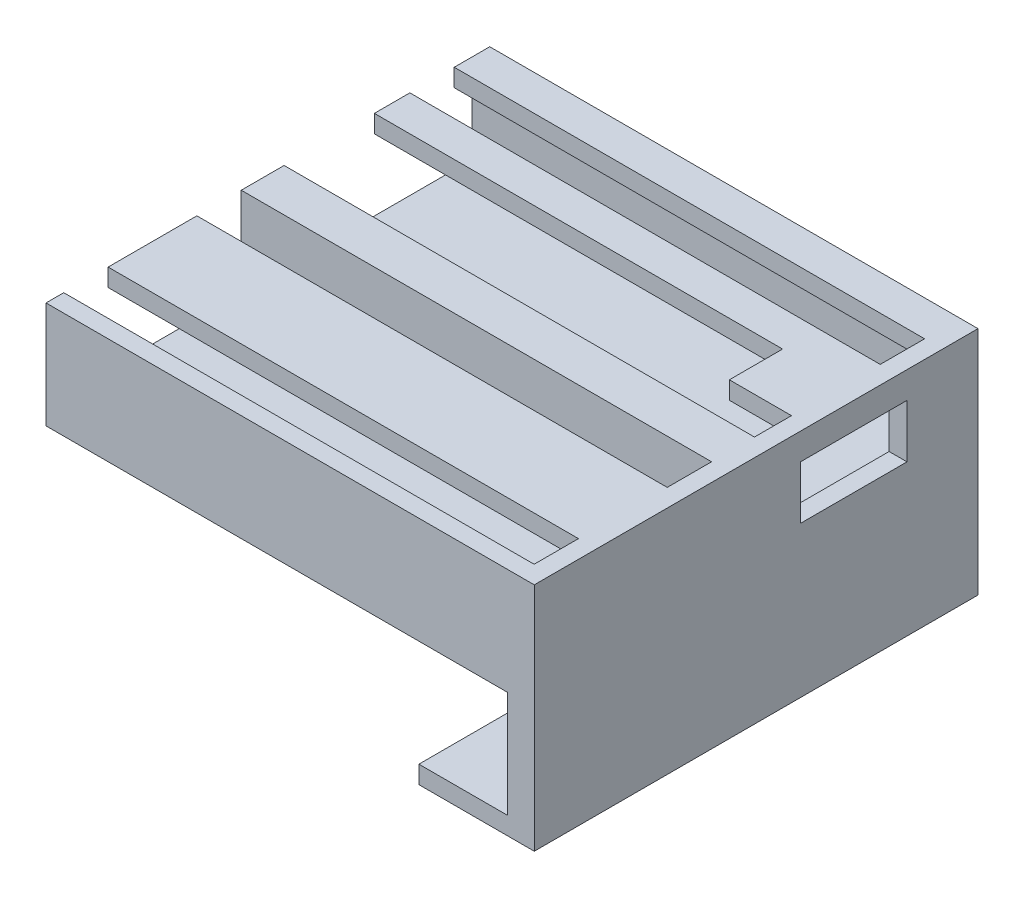
from build123d import *

# Parameters (mm, degrees)
SKETCH_1_W          = 55
SKETCH_1_H          = 50
EXTRUDE_1_DEPTH     = 2
SKETCH_2_W          = 2.016430074
SKETCH_2_H          = 50
EXTRUDE_2_DEPTH     = 10
SKETCH_4_W          = 10
SKETCH_4_H          = 2
SKETCH_4_W_2        = 2
SKETCH_4_H_2        = 10
EXTRUDE_3_DEPTH     = 53
SKETCH_5_W          = 12
SKETCH_5_H          = 6
CUT_EXTRUDE_1_DEPTH = 40
SKETCH_6_W          = 46
SKETCH_6_H          = 6
CUT_EXTRUDE_3_DEPTH = 2
SKETCH_7_W          = 3
SKETCH_7_H          = 50
EXTRUDE_4_DEPTH     = 14
SKETCH_8_W          = 50
SKETCH_8_H          = 2
EXTRUDE_5_DEPTH     = 10


with BuildPart() as part:
    # 草图1 → 凸台-拉伸1 (new body)
    with BuildSketch(Plane(origin=(0, 0, 0), x_dir=(1, 0, 0), z_dir=(0, 1, 0))):
        with Locations((-15.105645182, 3.897173973)):
            Rectangle(SKETCH_1_W, SKETCH_1_H)
    extrude(amount=EXTRUDE_1_DEPTH)

    # 草图2 → 凸台-拉伸2 (add)
    with BuildSketch(Plane(origin=(0, 2, 0), x_dir=(1, 0, 0), z_dir=(0, 1, 0))):
        with Locations((11.386139781, 3.897173973)):
            Rectangle(SKETCH_2_W, SKETCH_2_H)
    extrude(amount=EXTRUDE_2_DEPTH)

    # 草图4 → 凸台-拉伸3 (add)
    with BuildSketch(Plane.ZY.offset(-10.377924744)):
        with Locations((-14.897173973, 11)):
            Rectangle(SKETCH_4_W, SKETCH_4_H)
        Polygon((-28.897173973, 12), (-26.897173973, 12), (-24.897173973, 12), (-24.897173973, 10), (-26.897173973, 10), (-26.897173973, 2), (-28.897173973, 2), align=None)
        Polygon((-2.897173973, 10), (-2.897173973, 2), (-0.897173973, 2), (-0.897173973, 12), (-2.897173973, 12), (-5.725601098, 12), (-5.725601098, 10), align=None)
        with Locations((9.102826027, 11)):
            Rectangle(SKETCH_4_W, SKETCH_4_H)
        with Locations((20.102826027, 7)):
            Rectangle(SKETCH_4_W_2, SKETCH_4_H_2)
    extrude(amount=EXTRUDE_3_DEPTH)

    # 草图5 → 切除-拉伸1 (cut)
    with BuildSketch(Plane(origin=(12.394354818, 0, 0), x_dir=(0, 0, -1), z_dir=(1, 0, 0))):
        with Locations((14.897173973, 6)):
            Rectangle(SKETCH_5_W, SKETCH_5_H)
    extrude(amount=-CUT_EXTRUDE_1_DEPTH, mode=Mode.SUBTRACT)

    # 草图6 → 切除-拉伸3 (cut)
    with BuildSketch(Plane(origin=(0, 12, 0), x_dir=(1, 0, 0), z_dir=(0, 1, 0))):
        with Locations((-19.622075256, 12.897173973)):
            Rectangle(SKETCH_6_W, SKETCH_6_H)
    extrude(amount=-CUT_EXTRUDE_3_DEPTH, mode=Mode.SUBTRACT)

    # 草图7 → 凸台-拉伸4 (add)
    with BuildSketch(Plane.XZ):
        with Locations((10.894354818, -3.897173973)):
            Rectangle(SKETCH_7_W, SKETCH_7_H)
    extrude(amount=EXTRUDE_4_DEPTH)

    # 草图8 → 凸台-拉伸5 (add)
    with BuildSketch(Plane.ZY.offset(-9.394354818)):
        with Locations((-3.897173973, -13)):
            Rectangle(SKETCH_8_W, SKETCH_8_H)
    extrude(amount=EXTRUDE_5_DEPTH)


solid = part.part
